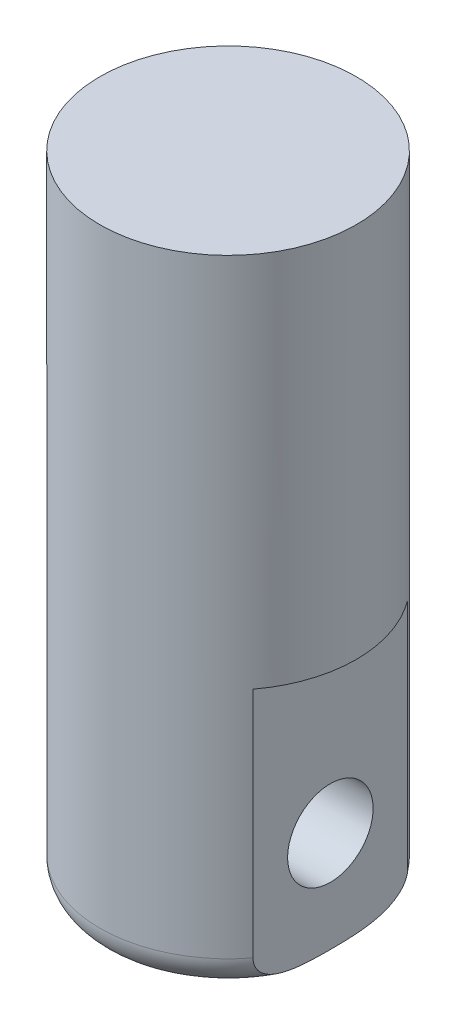
from build123d import *

# Parameters (mm, degrees)
SKETCH_1_R          = 12
EXTRUDE_1_DEPTH     = 60
FILLET_1_R          = 3
SKETCH_2_W          = 4.428763437
SKETCH_2_H          = 29.827900754
CUT_EXTRUDE_1_DEPTH = 40
SKETCH_6_R          = 4
CUT_EXTRUDE_2_DEPTH = 50


with BuildPart() as part:
    # Эскиз1 → Вытянуть1 (new body)
    with BuildSketch(Plane(origin=(0, 0, 0), x_dir=(1, 0, 0), z_dir=(0, 1, 0))):
        with Locations(Location((0, 0, 0), (0, 0, 270))):
            Circle(SKETCH_1_R)
    extrude(amount=EXTRUDE_1_DEPTH)

    # Скругление1
    fillet_1_edges = [part.edges().sort_by_distance(p)[0] for p in [
        (0, 0, -12),
    ]]
    fillet(fillet_1_edges, radius=FILLET_1_R)

    # Эскиз2 → Вырез-Вытянуть1 (cut, symmetric)
    with BuildSketch(Plane.XY):
        with Locations((-11.785618281, 9.858944965)):
            Rectangle(SKETCH_2_W, SKETCH_2_H)
        with Locations((11.785618281, 9.858944965)):
            Rectangle(SKETCH_2_W, SKETCH_2_H)
    extrude(amount=CUT_EXTRUDE_1_DEPTH, both=True, mode=Mode.SUBTRACT)

    # Эскиз6 → Вырез-Вытянуть2 (cut, symmetric)
    with BuildSketch(Plane.ZY.offset(9.571236563)):
        with Locations(Location((0, 9.5, 0), (0, 0, 270))):
            Circle(SKETCH_6_R)
    extrude(amount=CUT_EXTRUDE_2_DEPTH, both=True, mode=Mode.SUBTRACT)


solid = part.part
